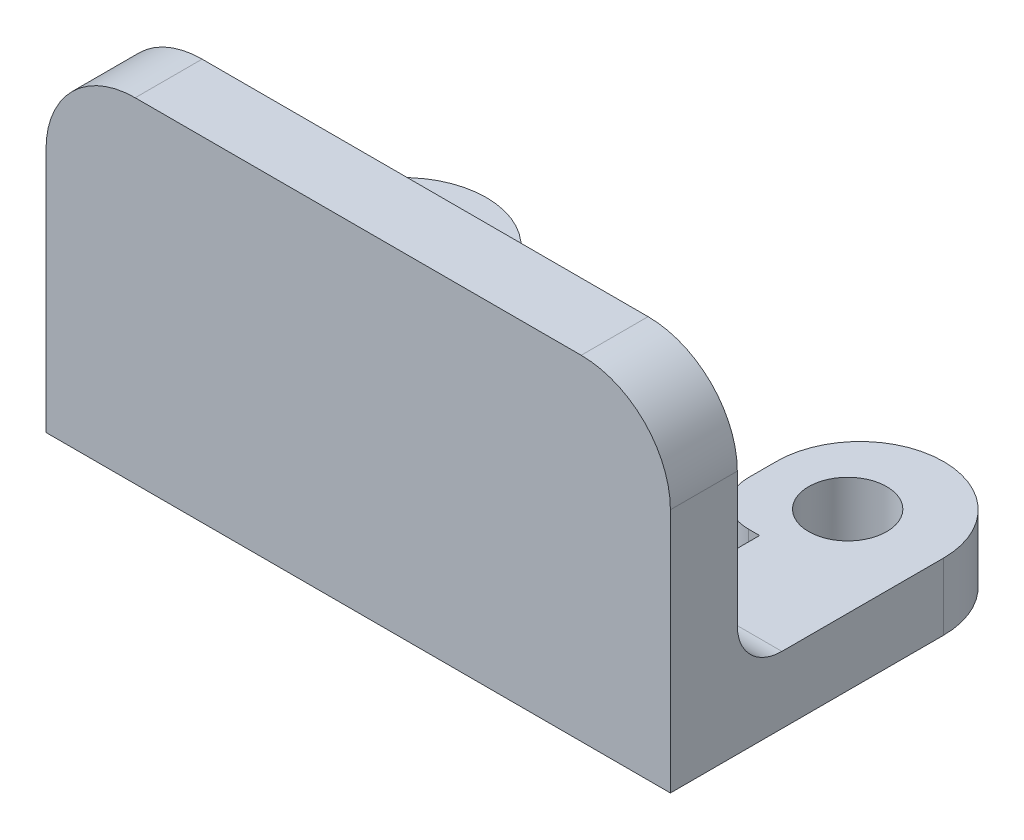
from build123d import *

# Parameters (mm, degrees)
SALIENTE_EXTRUIR1_DEPTH = 14
CROQUIS3_R              = 1.75
CORTAR_EXTRUIR1_DEPTH   = 30
REDONDEO3_R             = 4
REDONDEO4_R             = 2


with BuildPart() as part:
    # Croquis2 → Saliente-Extruir1 (new, symmetric)
    with BuildSketch(Plane(origin=(0, 0, 0), x_dir=(0, 0, -1), z_dir=(1, 0, 0))):
        with BuildLine():
            Line((-3, 1.5), (8, 1.5))
            Line((8, 1.5), (8, -1.5))
            Line((8, -1.5), (-8, -1.5))
            Line((-8, -1.5), (-8, 1.5))
            Line((-8, 1.5), (-8, 13.5))
            Line((-8, 13.5), (-5, 13.5))
            Line((-5, 13.5), (-5, 3.5))
            ThreePointArc((-5, 3.5), (-4.414213562, 2.085786438), (-3, 1.5))
        make_face()
    extrude(amount=SALIENTE_EXTRUIR1_DEPTH, both=True)

    # Croquis3 → Cortar-Extruir1 (cut)
    with BuildSketch(Plane(origin=(0, 1.5, 0), x_dir=(1, 0, 0), z_dir=(0, 1, 0))):
        with BuildLine():
            Line((-9, -2), (9, -2))
            Line((9, -2), (9, 1))
            Line((9, 1), (6.5, 1))
            Line((6.5, 1), (6.5, 4.25))
            ThreePointArc((6.5, 4.25), (7.598349575, 6.901650434), (10.250000013, 8))
            Line((10.250000013, 8), (6.5, 8))
            Line((6.5, 8), (-6.5, 8))
            Line((-6.5, 8), (-10.249999997, 8))
            ThreePointArc((-10.249999997, 8), (-7.598349569, 6.901650428), (-6.5, 4.25))
            Line((-6.5, 4.25), (-6.5, 1))
            Line((-6.5, 1), (-9, 1))
            Line((-9, 1), (-9, -2))
        make_face()
        with BuildLine():
            Line((14, 8), (10.250000013, 8))
            ThreePointArc((10.250000013, 8), (12.901650434, 6.901650425), (14, 4.25))
            Line((14, 4.25), (14, 8))
        make_face()
        with BuildLine():
            ThreePointArc((-14, 4.25), (-12.901650428, 6.901650431), (-10.249999997, 8))
            Line((-10.249999997, 8), (-14, 8))
            Line((-14, 8), (-14, 4.25))
        make_face()
        with Locations(Location((9.95, 4, 0), (0, 0, 270))):
            Circle(CROQUIS3_R)
        with Locations(Location((-9.95, 4, 0), (0, 0, 270))):
            Circle(CROQUIS3_R)
    extrude(amount=-CORTAR_EXTRUIR1_DEPTH, mode=Mode.SUBTRACT)

    # Redondeo3
    redondeo3_edges = [part.edges().sort_by_distance(p)[0] for p in [
        (-14, 13.5, 6.5),
        (14, 13.5, 6.5),
    ]]
    fillet(redondeo3_edges, radius=REDONDEO3_R)

    # Redondeo4
    redondeo4_edges = [part.edges().sort_by_distance(p)[0] for p in [
        (6.5, 0, -1),
        (-6.5, 0, -1),
    ]]
    fillet(redondeo4_edges, radius=REDONDEO4_R)


solid = part.part
